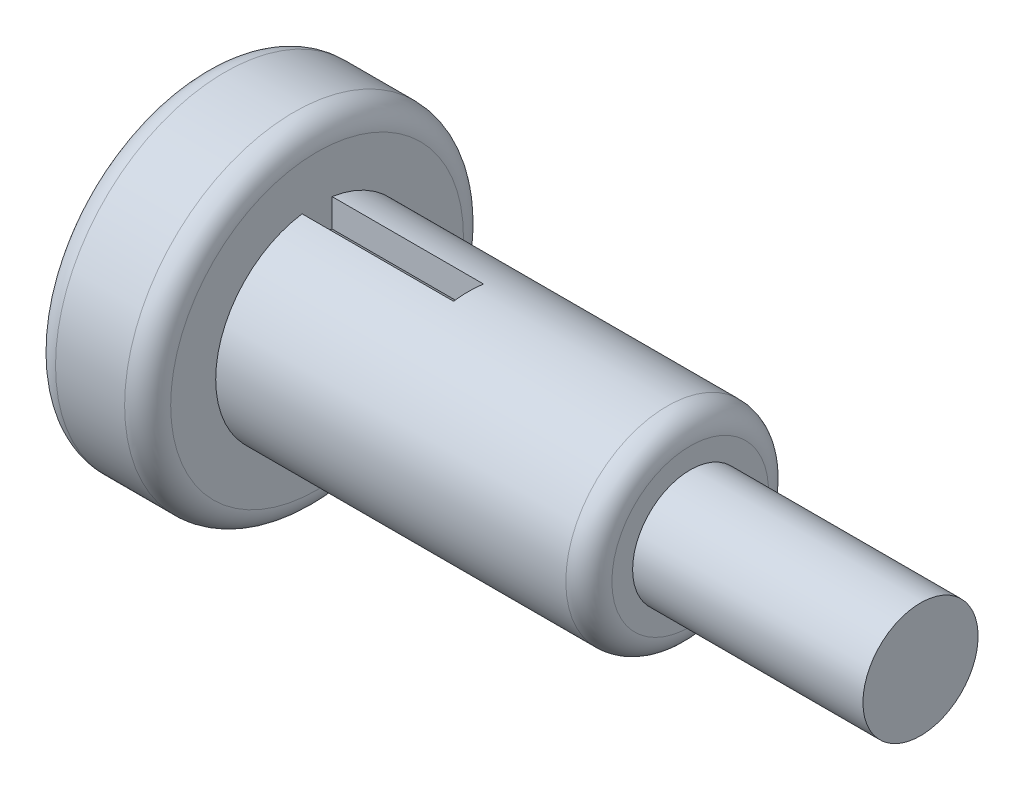
from build123d import *

# Parameters (mm, degrees)
CUT_EXTRUDE1_DEPTH = 3.25


with BuildPart() as part:
    # Sketch1 → Revolve3 (revolve)
    with BuildSketch(Plane(origin=(0, 0, 0), x_dir=(1, 0, 0), z_dir=(0, 1, 0)), mode=Mode.PRIVATE) as revolve3_sk:
        with BuildLine():
            Line((-25.676880223, 0), (44.323119777, 0))
            Line((44.323119777, 0), (44.323119777, 12.5))
            Line((44.323119777, 12.5), (-5.676880223, 12.5))
            Line((-5.676880223, 12.5), (-5.676880223, 17))
            ThreePointArc((-5.676880223, 17), (-7.141346317, 20.535533906), (-10.676880223, 22))
            Line((-10.676880223, 22), (-86.676880223, 22))
            Line((-86.676880223, 22), (-86.676880223, 31.774373259))
            ThreePointArc((-86.676880223, 31.774373259), (-88.141346317, 35.309907165), (-91.676880223, 36.774373259))
            Line((-91.676880223, 36.774373259), (-106.676880223, 36.774373259))
            ThreePointArc((-106.676880223, 36.774373259), (-110.212414129, 35.309907165), (-111.676880223, 31.774373259))
            Line((-111.676880223, 31.774373259), (-111.676880223, 21))
            ThreePointArc((-111.676880223, 21), (-110.212414129, 17.464466094), (-106.676880223, 16))
            Line((-106.676880223, 16), (-25.676880223, 16))
            Line((-25.676880223, 16), (-25.676880223, 0))
        make_face()
    revolve(revolve3_sk.sketch.rotate(Axis((-25.676880223, 0, 0), (1, 0, 0)), 180), axis=Axis((-25.676880223, 0, 0), (1, 0, 0)))

    # Sketch3 → Cut-Extrude1 (cut, symmetric)
    with BuildSketch(Plane.XY):
        Polygon((-86.676880223, 0), (-86.676880223, 50), (-51.676880223, 50), (-59.676880223, -56.407142019), (-86.676880223, -56.407142019), align=None)
    extrude(amount=CUT_EXTRUDE1_DEPTH, both=True, mode=Mode.SUBTRACT)


solid = part.part
